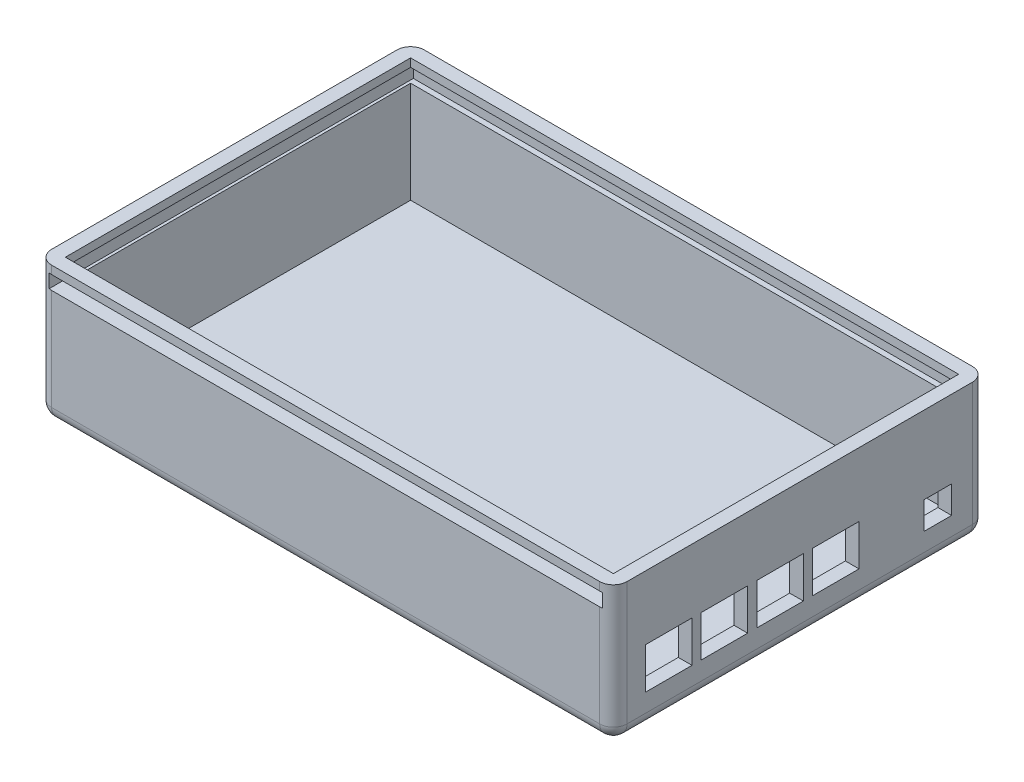
from build123d import *

# Parameters (mm, degrees)
SKETCH1_W           = 210
SKETCH1_H           = 136
SKETCH1_W_2         = 200
SKETCH1_H_2         = 126
EXTRUDE_THIN1_DEPTH = 50
SKETCH1_2_W         = 200
SKETCH1_2_H         = 126
BOSS_EXTRUDE1_DEPTH = 5
FILLET1_R           = 5
SKETCH2_W           = 202
SKETCH2_H           = 5
CUT_EXTRUDE1_DEPTH  = 133
SKETCH3_W           = 17
SKETCH3_H           = 15
SKETCH3_W_2         = 10
SKETCH3_H_2         = 10
CUT_EXTRUDE2_DEPTH  = 10


with BuildPart() as part:
    # Sketch1 → Extrude-Thin1 (new body)
    with BuildSketch(Plane(origin=(0, 0, 0), x_dir=(1, 0, 0), z_dir=(0, 1, 0))):
        with Locations((100, 63)):
            Rectangle(SKETCH1_W, SKETCH1_H)
        with Locations((100, 63)):
            Rectangle(SKETCH1_W_2, SKETCH1_H_2, mode=Mode.SUBTRACT)
    extrude(amount=EXTRUDE_THIN1_DEPTH)

    # Sketch1<2> → Boss-Extrude1 (add)
    with BuildSketch(Plane(origin=(0, 0, 0), x_dir=(1, 0, 0), z_dir=(0, 1, 0))):
        with Locations((100, 63)):
            Rectangle(SKETCH1_2_W, SKETCH1_2_H)
    extrude(amount=BOSS_EXTRUDE1_DEPTH)

    # Fillet1
    fillet1_edges = [part.edges().sort_by_distance(p)[0] for p in [
        (-5, 0, -63),
        (-5, 25, -131),
        (100, 0, -131),
        (205, 25, -131),
        (205, 0, -63),
        (205, 25, 5),
        (100, 0, 5),
        (-5, 25, 5),
    ]]
    fillet(fillet1_edges, radius=FILLET1_R)

    # Sketch2 → Cut-Extrude1 (cut)
    with BuildSketch(Plane.XY.offset(5)):
        with Locations((100, 44.5)):
            Rectangle(SKETCH2_W, SKETCH2_H)
    extrude(amount=-CUT_EXTRUDE1_DEPTH, mode=Mode.SUBTRACT)

    # Sketch3 → Cut-Extrude2 (cut)
    with BuildSketch(Plane(origin=(205, 0, 0), x_dir=(0, 0, -1), z_dir=(1, 0, 0))):
        with Locations((15.19, 19.17)):
            Rectangle(SKETCH3_W, SKETCH3_H)
        with Locations((35.51, 19.17)):
            Rectangle(SKETCH3_W, SKETCH3_H)
        with Locations((55.83, 19.17)):
            Rectangle(SKETCH3_W, SKETCH3_H)
        with Locations((76.15, 19.17)):
            Rectangle(SKETCH3_W, SKETCH3_H)
        with Locations((113.435, 16.67)):
            Rectangle(SKETCH3_W_2, SKETCH3_H_2)
    extrude(amount=-CUT_EXTRUDE2_DEPTH, mode=Mode.SUBTRACT)


solid = part.part
